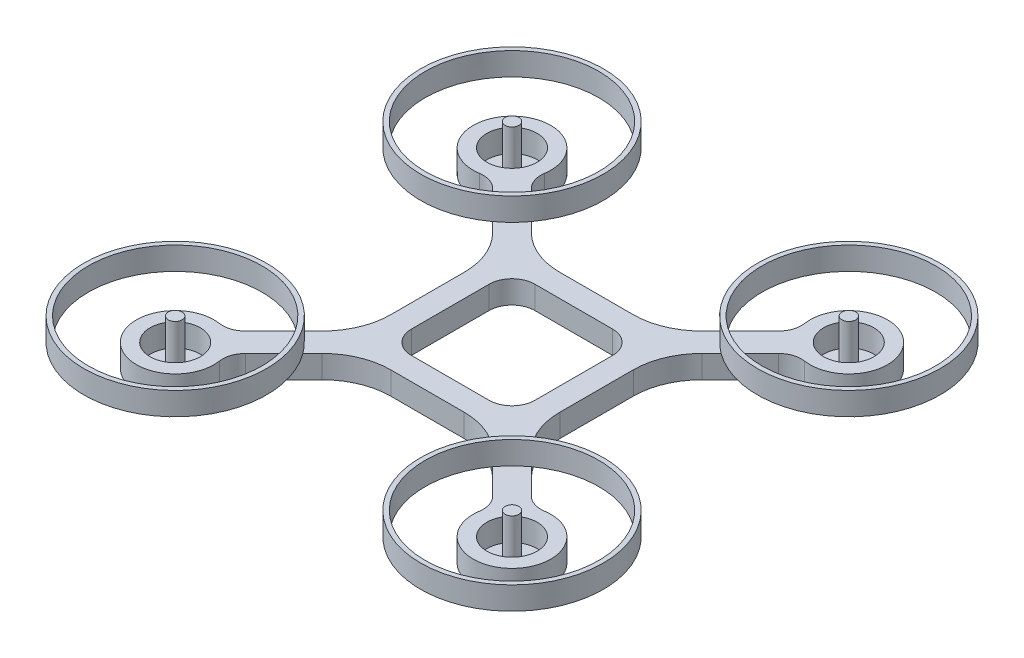
from build123d import *

# Parameters (mm, degrees)
SKETCH1_R            = 5.5
BOSS_EXTRUDE2_DEPTH  = 5
SKETCH3_R            = 20
SKETCH3_R_2          = 19
BOSS_EXTRUDE4_DEPTH  = 5
LPATTERN1_COUNT      = 2
LPATTERN1_PITCH      = 73.73
LPATTERN1_COUNT_DIR2 = 2
LPATTERN1_PITCH_DIR2 = 73.73
BOSS_EXTRUDE5_START  = 2
SKETCH4_R            = 5.5
BOSS_EXTRUDE5_DEPTH  = 2
SKETCH5_R            = 1.5
BOSS_EXTRUDE6_DEPTH  = 10
LPATTERN2_COUNT      = 2
LPATTERN2_PITCH      = 73.73
LPATTERN2_COUNT_DIR2 = 2
LPATTERN2_PITCH_DIR2 = 73.73


with BuildPart() as part:
    # Sketch1 → Boss-Extrude2 (new body)
    with BuildSketch(Plane(origin=(0, 0, 0), x_dir=(1, 0, 0), z_dir=(0, 1, 0))):
        with BuildLine():
            Line((8.044155877, 18.5), (-8.044155877, 18.5))
            ThreePointArc((-8.044155877, 18.5), (-13.784407363, 19.641807012), (-18.650757595, 22.893398282))
            Line((-18.650757595, 22.893398282), (-27.052915884, 31.295556571))
            ThreePointArc((-27.052915884, 31.295556571), (-28.268042905, 33.271853242), (-28.460394015, 35.583840107))
            ThreePointArc((-28.460394015, 35.583840107), (-42.873922117, 42.873922117), (-35.583840107, 28.460394015))
            ThreePointArc((-35.583840107, 28.460394015), (-33.271853242, 28.268042905), (-31.295556571, 27.052915884))
            Line((-31.295556571, 27.052915884), (-22.893398282, 18.650757595))
            ThreePointArc((-22.893398282, 18.650757595), (-19.641807012, 13.784407363), (-18.5, 8.044155877))
            Line((-18.5, 8.044155877), (-18.5, -8.044155877))
            ThreePointArc((-18.5, -8.044155877), (-19.641807012, -13.784407363), (-22.893398282, -18.650757595))
            Line((-22.893398282, -18.650757595), (-31.295556571, -27.052915884))
            ThreePointArc((-31.295556571, -27.052915884), (-33.271853242, -28.268042905), (-35.583840107, -28.460394015))
            ThreePointArc((-35.583840107, -28.460394015), (-42.873922117, -42.873922117), (-28.460394015, -35.583840107))
            ThreePointArc((-28.460394015, -35.583840107), (-28.268042905, -33.271853242), (-27.052915884, -31.295556571))
            Line((-27.052915884, -31.295556571), (-18.650757595, -22.893398282))
            ThreePointArc((-18.650757595, -22.893398282), (-13.784407363, -19.641807012), (-8.044155877, -18.5))
            Line((-8.044155877, -18.5), (8.044155877, -18.5))
            ThreePointArc((8.044155877, -18.5), (13.784407363, -19.641807012), (18.650757595, -22.893398282))
            Line((18.650757595, -22.893398282), (27.052915884, -31.295556571))
            ThreePointArc((27.052915884, -31.295556571), (28.268042905, -33.271853242), (28.460394015, -35.583840107))
            ThreePointArc((28.460394015, -35.583840107), (42.873922117, -42.873922117), (35.583840107, -28.460394015))
            ThreePointArc((35.583840107, -28.460394015), (33.271853242, -28.268042905), (31.295556571, -27.052915884))
            Line((31.295556571, -27.052915884), (22.893398282, -18.650757595))
            ThreePointArc((22.893398282, -18.650757595), (19.641807012, -13.784407363), (18.5, -8.044155877))
            Line((18.5, -8.044155877), (18.5, 8.044155877))
            ThreePointArc((18.5, 8.044155877), (19.641807012, 13.784407363), (22.893398282, 18.650757595))
            Line((22.893398282, 18.650757595), (31.295556571, 27.052915884))
            ThreePointArc((31.295556571, 27.052915884), (33.271853242, 28.268042905), (35.583840107, 28.460394015))
            ThreePointArc((35.583840107, 28.460394015), (42.873922117, 42.873922117), (28.460394015, 35.583840107))
            ThreePointArc((28.460394015, 35.583840107), (28.268042905, 33.271853242), (27.052915884, 31.295556571))
            Line((27.052915884, 31.295556571), (18.650757595, 22.893398282))
            ThreePointArc((18.650757595, 22.893398282), (13.784407363, 19.641807012), (8.044155877, 18.5))
        make_face()
        with Locations(Location((36.863514477, 36.863514477, 0), (0, 0, 270))):
            Circle(SKETCH1_R, mode=Mode.SUBTRACT)
        with Locations(Location((36.863514477, -36.863514477, 0), (0, 0, 270))):
            Circle(SKETCH1_R, mode=Mode.SUBTRACT)
        with Locations(Location((-36.863514477, -36.863514477, 0), (0, 0, 270))):
            Circle(SKETCH1_R, mode=Mode.SUBTRACT)
        with Locations(Location((-36.863514477, 36.863514477, 0), (0, 0, 270))):
            Circle(SKETCH1_R, mode=Mode.SUBTRACT)
        with BuildLine():
            Line((8.512593284, 13.512593284), (-8.512593284, 13.512593284))
            ThreePointArc((-8.512593284, 13.512593284), (-12.04812719, 12.04812719), (-13.512593284, 8.512593284))
            Line((-13.512593284, 8.512593284), (-13.512593284, -8.512593284))
            ThreePointArc((-13.512593284, -8.512593284), (-12.04812719, -12.04812719), (-8.512593284, -13.512593284))
            Line((-8.512593284, -13.512593284), (8.512593284, -13.512593284))
            ThreePointArc((8.512593284, -13.512593284), (12.04812719, -12.04812719), (13.512593284, -8.512593284))
            Line((13.512593284, -8.512593284), (13.512593284, 8.512593284))
            ThreePointArc((13.512593284, 8.512593284), (12.04812719, 12.04812719), (8.512593284, 13.512593284))
        make_face(mode=Mode.SUBTRACT)
    extrude(amount=BOSS_EXTRUDE2_DEPTH)

    # Sketch3 → Boss-Extrude4 (add)
    with BuildSketch(Plane(origin=(0, 5, 0), x_dir=(1, 0, 0), z_dir=(0, 1, 0))):
        with Locations(Location((36.863514477, -36.863514477, 0), (0, 0, 126.373073441))):
            Circle(SKETCH3_R)
        with Locations(Location((36.863514477, -36.863514477, 0), (0, 0, 125.915279713))):
            Circle(SKETCH3_R_2, mode=Mode.SUBTRACT)
    boss_extrude4 = extrude(amount=BOSS_EXTRUDE4_DEPTH)

    # LPattern1: Boss-Extrude4 2 × 2
    with Locations(*[(-j * LPATTERN1_PITCH_DIR2, 0, -i * LPATTERN1_PITCH) for i in range(LPATTERN1_COUNT) for j in range(LPATTERN1_COUNT_DIR2) if (i, j) != (0, 0)]):
        add(boss_extrude4)

    # Sketch4 → Boss-Extrude5 (add)
    with BuildSketch(Plane.XZ.offset(BOSS_EXTRUDE5_START)):
        with Locations(Location((-36.863514477, 36.863514477, 0), (0, 0, 270))):
            Circle(SKETCH4_R)
        with Locations(Location((36.866485523, 36.863514477, 0), (0, 0, 90.015475294))):
            Circle(SKETCH4_R)
        with Locations(Location((36.866485523, -36.866485523, 0), (0, 0, 45.021885374))):
            Circle(SKETCH4_R)
        with Locations(Location((-36.863514477, -36.866485523, 0), (0, 0, 0.015475288))):
            Circle(SKETCH4_R)
    extrude(amount=-BOSS_EXTRUDE5_DEPTH)


with BuildPart() as boss_extrude5_piece_1:
    # of the separate pieces the step leaves, piece 1, a body of its own (boss_extrude5_pieces)
    add(part.part.solids().sort_by_distance((28.460394015, 0, -35.583840107))[0])

    # Sketch5 → Boss-Extrude6 (add)
    with BuildSketch(Plane(origin=(0, 0, 0), x_dir=(1, 0, 0), z_dir=(0, 1, 0))):
        with Locations(Location((36.863514477, -36.863514477, 0), (0, 0, 90))):
            Circle(SKETCH5_R)
    boss_extrude6 = extrude(amount=BOSS_EXTRUDE6_DEPTH)



with BuildPart() as boss_extrude5_piece_2:
    # of the separate pieces the step leaves, piece 2, a body of its own (boss_extrude5_pieces)
    add(part.part.solids().sort_by_distance((-36.863514477, -2, 31.363514477))[0])


with BuildPart() as boss_extrude5_piece_1_1:
    add(boss_extrude5_piece_1.part)

    add(boss_extrude5_piece_2.part)  # LPattern2 merges Boss-Extrude5 piece 2
    # LPattern2: Boss-Extrude6 2 × 2
    with Locations(*[(-i * LPATTERN2_PITCH, 0, -j * LPATTERN2_PITCH_DIR2) for i in range(LPATTERN2_COUNT) for j in range(LPATTERN2_COUNT_DIR2) if (i, j) != (0, 0)]):
        add(boss_extrude6)


solid = boss_extrude5_piece_1_1.part
